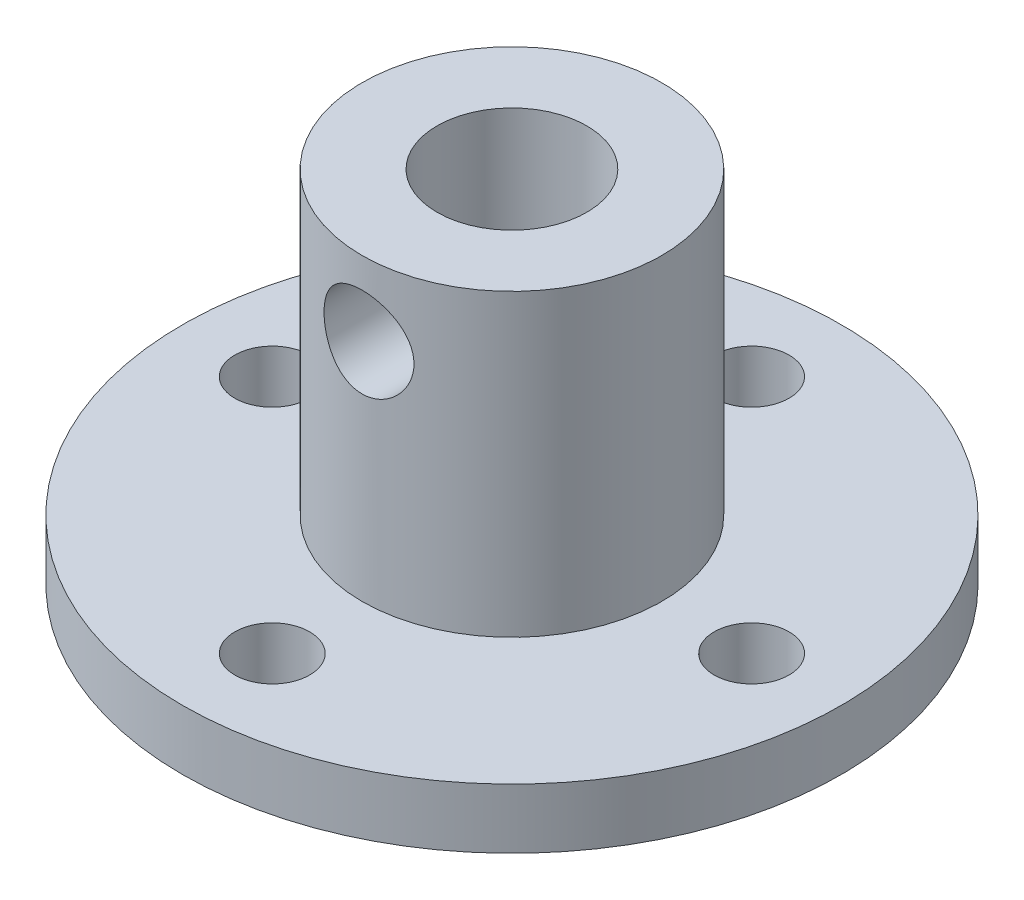
from build123d import *

# Parameters (mm, degrees)
SKETCH_1_R               = 11
SKETCH_1_R_2             = 1.25
EXTRUDE_1_DEPTH          = 2
SKETCH_2_R               = 5
SKETCH_2_R_2             = 2.5
EXTRUDE_2_DEPTH          = 10
CUT_EXTRUDE_1_REACH      = 21.647
CUT_EXTRUDE_1_END_RADIUS = 5
SKETCH_3_R               = 1.5


with BuildPart() as part:
    # 草圖1 → 填料-伸長1 (new body)
    with BuildSketch(Plane(origin=(0, 0, 0), x_dir=(1, 0, 0), z_dir=(0, 1, 0))):
        with Locations(Location((0, 0, 0), (0, 0, 270))):
            Circle(SKETCH_1_R)
        with Locations(Location((0, 8, 0), (0, 0, 270))):
            Circle(SKETCH_1_R_2, mode=Mode.SUBTRACT)
        with Locations(Location((8, 0, 0), (0, 0, 270))):
            Circle(SKETCH_1_R_2, mode=Mode.SUBTRACT)
        with Locations(Location((0, -8, 0), (0, 0, 270))):
            Circle(SKETCH_1_R_2, mode=Mode.SUBTRACT)
        with Locations(Location((-8, 0, 0), (0, 0, 270))):
            Circle(SKETCH_1_R_2, mode=Mode.SUBTRACT)
    extrude(amount=EXTRUDE_1_DEPTH)

    # 草圖2 → 填料-伸長2 (add)
    with BuildSketch(Plane(origin=(0, 2, 0), x_dir=(1, 0, 0), z_dir=(0, 1, 0))):
        with Locations(Location((0, 0, 0), (0, 0, 270))):
            Circle(SKETCH_2_R)
        with Locations(Location((0, 0, 0), (0, 0, 270))):
            Circle(SKETCH_2_R_2, mode=Mode.SUBTRACT)
    extrude(amount=EXTRUDE_2_DEPTH)

    # 除料-伸長1: up to this cylinder (the profile starts inside it)
    cut_extrude_1_end = Plane(origin=(0, 9.5, 0), z_dir=(0, -1, 0)) * Cylinder(CUT_EXTRUDE_1_END_RADIUS, 54.294, mode=Mode.PRIVATE)
    # 草圖3 → 除料-伸長1 (cut, up to the surface)
    with BuildSketch(Plane.XY, mode=Mode.PRIVATE) as cut_extrude_1_sk1:
        with Locations(Location((0, 9.5, 0), (0, 0, 180))):
            Circle(SKETCH_3_R)
    cut_extrude_1_tool1 = extrude(cut_extrude_1_sk1.sketch, amount=CUT_EXTRUDE_1_REACH, mode=Mode.PRIVATE) & cut_extrude_1_end
    add(cut_extrude_1_tool1.solids().sort_by_distance((0, 9.5, 0))[0], mode=Mode.SUBTRACT)


solid = part.part
